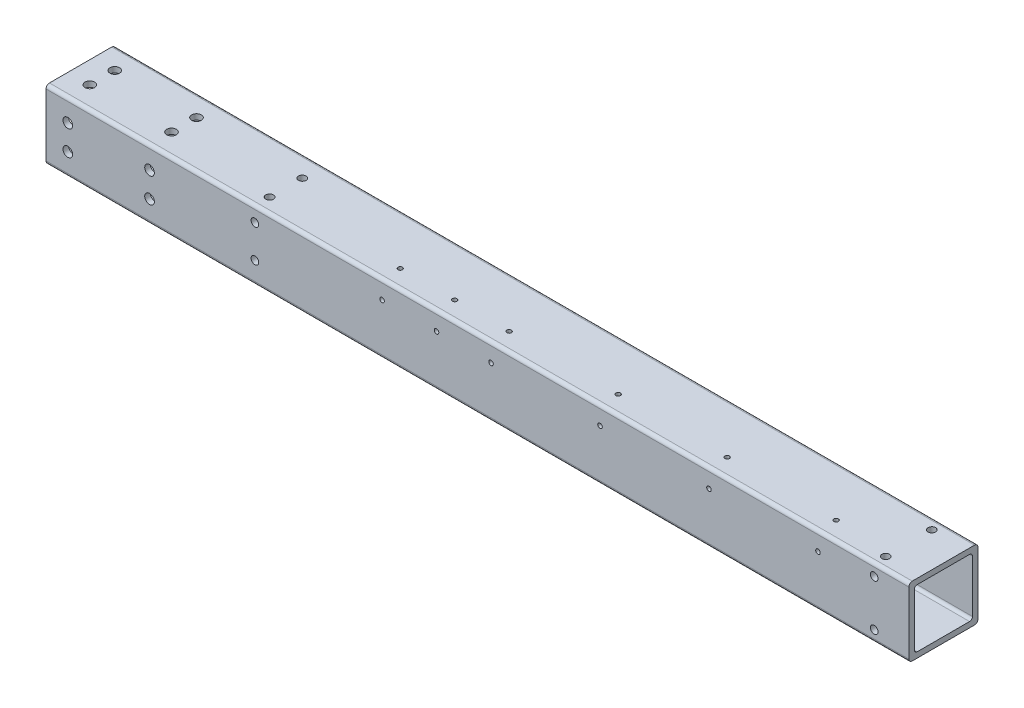
from build123d import *

# Parameters (mm, degrees)
BOSS_EXTRUDE1_DEPTH                  = 237.5
BOSS_EXTRUDE1_DEPTH_BACK             = 237.5
TAP_DRILL_FOR_M5X0_8_TAP1_D          = 4.2
TAP_DRILL_FOR_M5X0_8_TAP1_DEPTH      = 3.048
TAP_DRILL_FOR_M3X0_5_TAP1_D          = 2.5
TAP_DRILL_FOR_M3X0_5_TAP1_DEPTH      = 3.048
TAP_DRILL_FOR_M5X0_8_TAP2_AT_2_COUNT = 2
TAP_DRILL_FOR_M5X0_8_TAP2_AT_2_PITCH = 25.4
M5_CLEARANCE_HOLE1_D                 = 5.3
M5_CLEARANCE_HOLE1_DEPTH             = 3.048
F_8_0_8_DIAMETER_HOLE1_D             = 8
F_8_0_8_DIAMETER_HOLE1_DEPTH         = 3.048
F_8_0_8_DIAMETER_HOLE2_D             = 8
F_8_0_8_DIAMETER_HOLE2_DEPTH         = 3.048


with BuildPart() as part:
    # Sketch4 → Boss-Extrude1 (new, two sides: drawn at the far end of the back side and taken through both)
    with BuildSketch(Plane(origin=(0, 0, 0), x_dir=(0, 0, -1), z_dir=(1, 0, 0)).offset(-BOSS_EXTRUDE1_DEPTH_BACK)):
        with BuildLine():
            Line((19.05, -17.145), (19.05, 17.145))
            ThreePointArc((19.05, 17.145), (18.492038418, 18.492038418), (17.145, 19.05))
            Line((17.145, 19.05), (-17.145, 19.05))
            ThreePointArc((-17.145, 19.05), (-18.492038418, 18.492038418), (-19.05, 17.145))
            Line((-19.05, 17.145), (-19.05, -17.145))
            ThreePointArc((-19.05, -17.145), (-18.492038418, -18.492038418), (-17.145, -19.05))
            Line((-17.145, -19.05), (17.145, -19.05))
            ThreePointArc((17.145, -19.05), (18.492038418, -18.492038418), (19.05, -17.145))
        make_face()
        with BuildLine():
            Line((16.002, 14.4018), (16.002, -14.4018))
            ThreePointArc((16.002, -14.4018), (15.533312271, -15.533312271), (14.4018, -16.002))
            Line((14.4018, -16.002), (-14.4018, -16.002))
            ThreePointArc((-14.4018, -16.002), (-15.533312271, -15.533312271), (-16.002, -14.4018))
            Line((-16.002, -14.4018), (-16.002, 14.4018))
            ThreePointArc((-16.002, 14.4018), (-15.533312271, 15.533312271), (-14.4018, 16.002))
            Line((-14.4018, 16.002), (14.4018, 16.002))
            ThreePointArc((14.4018, 16.002), (15.533312271, 15.533312271), (16.002, 14.4018))
        make_face(mode=Mode.SUBTRACT)
    extrude(amount=BOSS_EXTRUDE1_DEPTH + BOSS_EXTRUDE1_DEPTH_BACK)

    # Tap Drill for M5x0.8 Tap1
    with Locations(Plane(origin=(0, 19.05, 0), x_dir=(1, 0, 0), z_dir=(0, 1, 0))):
        with Locations((-122.5, 7.05), (-122.5, -10.95)):
            tap_drill_for_m5x0_8_tap1 = Hole(TAP_DRILL_FOR_M5X0_8_TAP1_D / 2, depth=TAP_DRILL_FOR_M5X0_8_TAP1_DEPTH)

    # Tap Drill for M3x0.5 Tap1
    with Locations(Plane.XY.offset(19.05)):
        with Locations((187.5, 9.05), (127.5, 9.05), (67.5, 9.05), (7.5, 9.05), (-52.5, 9.05), (-22.5, 9.05)):
            tap_drill_for_m3x0_5_tap1 = Hole(TAP_DRILL_FOR_M3X0_5_TAP1_D / 2, depth=TAP_DRILL_FOR_M3X0_5_TAP1_DEPTH)

    # Sketch22 → Tap Drill for M5x0.8 Tap2 (revolve, cut)
    with BuildSketch(Plane(origin=(218.45, 12.7, 19.05), x_dir=(0, -1, 0), z_dir=(1, 0, 0))):
        Polygon((0, 0), (0, 6.2618073), (2.1, 5), (2.1, 0), align=None)
    tap_drill_for_m5x0_8_tap2 = revolve(axis=Axis((218.45, 12.7, 25.4), (0, 0, -1)), mode=Mode.SUBTRACT)

    # Tap Drill for M5x0.8 Tap2 at 2: Tap Drill for M5x0.8 Tap2 ×2
    with Locations(*[(0, -i * TAP_DRILL_FOR_M5X0_8_TAP2_AT_2_PITCH, 0) for i in range(1, TAP_DRILL_FOR_M5X0_8_TAP2_AT_2_COUNT)]):
        add(tap_drill_for_m5x0_8_tap2, mode=Mode.SUBTRACT)

    # Mirror1: Tap Drill for M5x0.8 Tap1, Tap Drill for M3x0.5 Tap1, Tap Drill for M5x0.8 Tap2 across plane
    add(tap_drill_for_m5x0_8_tap1.mirror(Plane(origin=(0, 0, 0), x_dir=(0, 0.7071067811865478, 0.7071067811865472), z_dir=(0, -0.7071067811865475, 0.7071067811865477))), mode=Mode.SUBTRACT)
    add(tap_drill_for_m3x0_5_tap1.mirror(Plane(origin=(0, 0, 0), x_dir=(0, 0.7071067811865478, 0.7071067811865472), z_dir=(0, -0.7071067811865475, 0.7071067811865477))), mode=Mode.SUBTRACT)
    add(tap_drill_for_m5x0_8_tap2.mirror(Plane(origin=(0, 0, 0), x_dir=(0, 0.7071067811865478, 0.7071067811865472), z_dir=(0, -0.7071067811865475, 0.7071067811865477))), mode=Mode.SUBTRACT)

    # Mirror1 copy 1 sketch → Mirror1 copy 1 (revolve, cut)
    with BuildSketch(Plane(origin=(218.45, 19.05, -12.7), x_dir=(0, 0, -1), z_dir=(1, 0, 0))):
        Polygon((0, 0), (0, -6.2618073), (2.1, -5), (2.1, 0), align=None)
    revolve(axis=Axis((218.45, 25.4, -12.7), (0, 1, 0)), mode=Mode.SUBTRACT)

    # M5 Clearance Hole1
    with Locations(Plane(origin=(0, 19.05, 0), x_dir=(1, 0, 0), z_dir=(0, 1, 0))):
        with Locations((-225.5, 6.8), (-225.5, -6.95), (-180.5, -6.95), (-180.5, 6.8)):
            m5_clearance_hole1 = Hole(M5_CLEARANCE_HOLE1_D / 2, depth=M5_CLEARANCE_HOLE1_DEPTH)

    # Mirror2: M5 Clearance Hole1 across plane
    add(m5_clearance_hole1.mirror(Plane(origin=(0, 0, 0), x_dir=(0, 0.7071067811865478, 0.7071067811865472), z_dir=(0, -0.7071067811865475, 0.7071067811865477))), mode=Mode.SUBTRACT)

    # Ø8.0 (8) Diameter Hole1
    with Locations(Plane.XY.offset(-16.002)):
        with Locations((-225.5, -6.8), (-225.5, 6.95), (-180.5, 6.95), (-180.5, -6.8)):
            Hole(F_8_0_8_DIAMETER_HOLE1_D / 2, depth=F_8_0_8_DIAMETER_HOLE1_DEPTH)

    # Ø8.0 (8) Diameter Hole2
    with Locations(Plane(origin=(0, -16.002, 0), x_dir=(1, 0, 0), z_dir=(0, 1, 0))):
        with Locations((-225.5, 6.8), (-225.5, -6.95), (-180.5, -6.95), (-180.5, 6.8)):
            Hole(F_8_0_8_DIAMETER_HOLE2_D / 2, depth=F_8_0_8_DIAMETER_HOLE2_DEPTH)


solid = part.part
